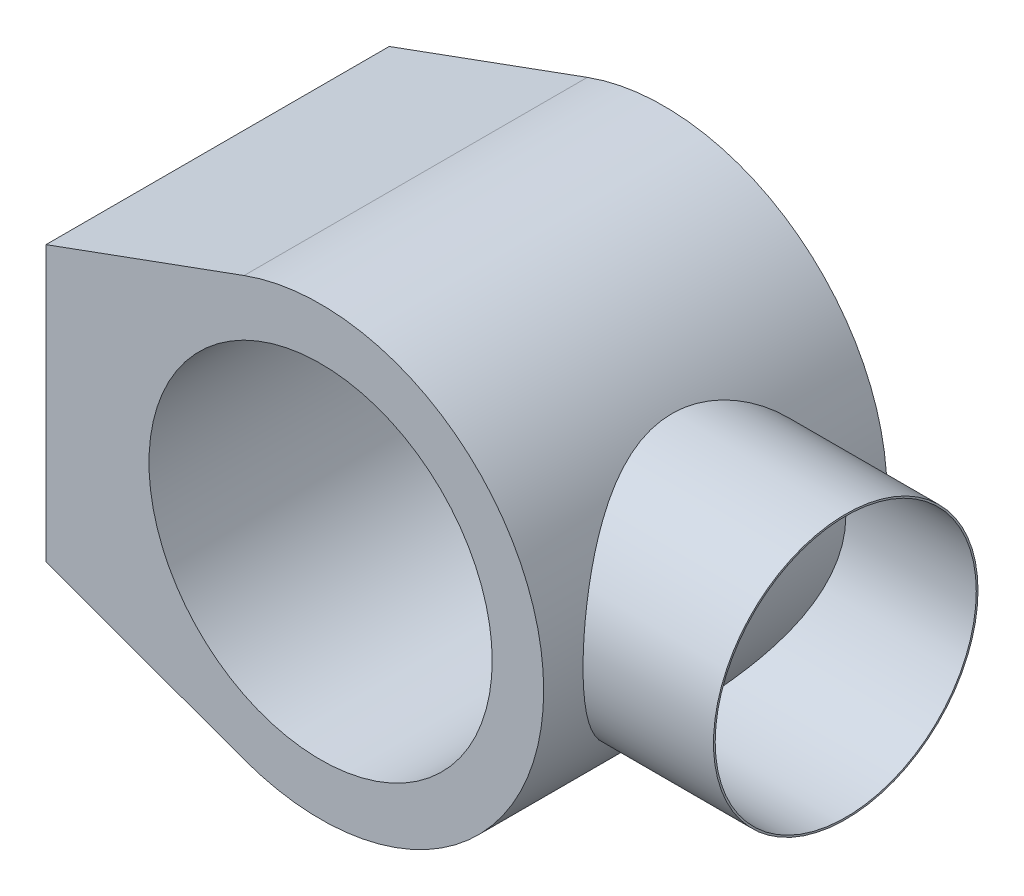
from build123d import *

# Parameters (mm, degrees)
SKETCH1_R                = 50
BOSS_EXTRUDE1_DEPTH      = 50
BOSS_EXTRUDE2_REACH      = 202.534
BOSS_EXTRUDE2_END_RADIUS = 65
SKETCH2_R                = 38.535
SKETCH2_R_2              = 38.035


with BuildPart() as part:
    # Sketch1 → Boss-Extrude1 (new, symmetric)
    with BuildSketch(Plane.XY):
        with BuildLine():
            Line((-80, 40), (-80, -40))
            Line((-80, -40), (-22.281665693, -61.061668614))
            ThreePointArc((-22.281665693, -61.061668614), (65, 0), (-22.281665693, 61.061668614))
            Line((-22.281665693, 61.061668614), (-80, 40))
        make_face()
        Circle(SKETCH1_R, mode=Mode.SUBTRACT)
    extrude(amount=BOSS_EXTRUDE1_DEPTH, both=True)

    # Boss-Extrude2: up to this cylinder (the profile starts outside it)
    boss_extrude2_end = Plane(origin=(0, 0, 38.426007), z_dir=(0, 0, -1)) * Cylinder(BOSS_EXTRUDE2_END_RADIUS, 536.068, mode=Mode.PRIVATE)
    # Sketch2 → Boss-Extrude2 (add, up to the surface)
    with BuildSketch(Plane(origin=(103, 0, 0), x_dir=(0, 0, -1), z_dir=(1, 0, 0)), mode=Mode.PRIVATE) as boss_extrude2_sk1:
        Circle(SKETCH2_R)
        Circle(SKETCH2_R_2, mode=Mode.SUBTRACT)
    boss_extrude2_tool1 = extrude(boss_extrude2_sk1.sketch, amount=-BOSS_EXTRUDE2_REACH, mode=Mode.PRIVATE) - boss_extrude2_end
    add(boss_extrude2_tool1.solids().sort_by_distance((103, 0, 38.426007))[0])


solid = part.part
